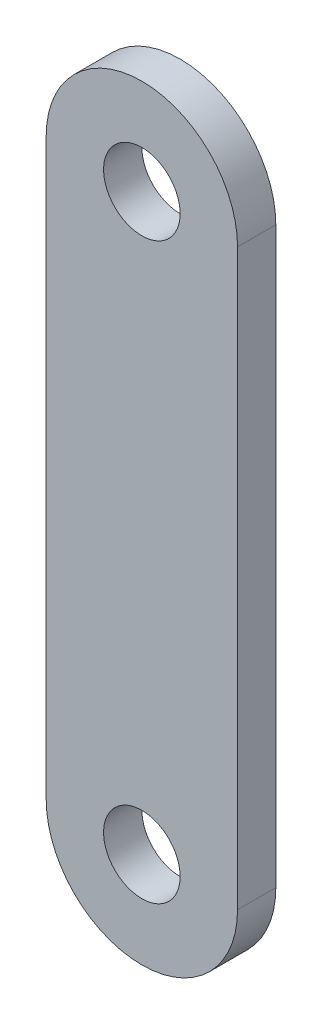
from build123d import *

# Parameters (mm, degrees)
CROQUIS1_R              = 10
SALIENTE_EXTRUIR1_DEPTH = 10


with BuildPart() as part:
    # Croquis1 → Saliente-Extruir1 (new body)
    with BuildSketch(Plane.XY):
        with BuildLine():
            Line((50, 0), (50, 150))
            ThreePointArc((50, 150), (25, 175), (0, 150))
            Line((0, 150), (0, 0))
            ThreePointArc((0, 0), (25, -25), (50, 0))
        make_face()
        with Locations((25, 150)):
            Circle(CROQUIS1_R, mode=Mode.SUBTRACT)
        with Locations((25, 0)):
            Circle(CROQUIS1_R, mode=Mode.SUBTRACT)
    extrude(amount=SALIENTE_EXTRUIR1_DEPTH)


solid = part.part
